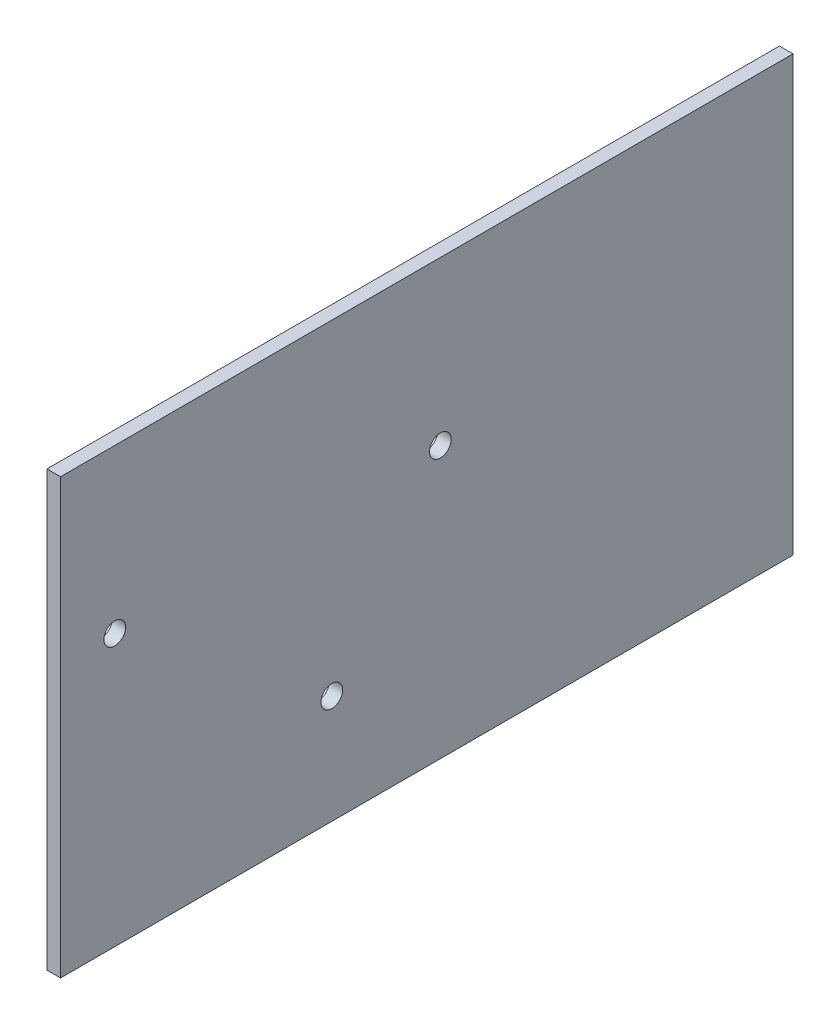
from build123d import *

# Parameters (mm, degrees)
SKETCH1_W           = 171.45
SKETCH1_H           = 101.6
SKETCH1_R           = 2.54
BOSS_EXTRUDE1_DEPTH = 3.175


with BuildPart() as part:
    # Sketch1 → Boss-Extrude1 (new body)
    with BuildSketch(Plane(origin=(0, 0, 0), x_dir=(0, 0, -1), z_dir=(1, 0, 0))):
        with Locations((15.441164676, 49.109973191)):
            Rectangle(SKETCH1_W, SKETCH1_H)
        with Locations((-57.583835324, 61.809973191)):
            Circle(SKETCH1_R, mode=Mode.SUBTRACT)
        with Locations((18.616164676, 61.809973191)):
            Circle(SKETCH1_R, mode=Mode.SUBTRACT)
        with Locations((-6.783835324, 23.709973191)):
            Circle(SKETCH1_R, mode=Mode.SUBTRACT)
    extrude(amount=-BOSS_EXTRUDE1_DEPTH)


solid = part.part
